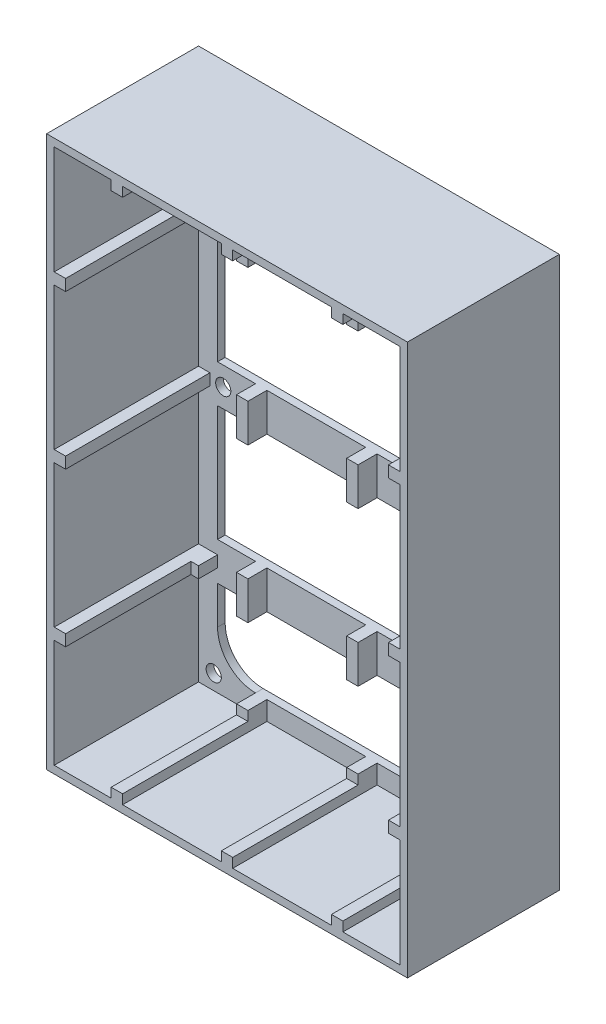
from build123d import *

# Parameters (mm, degrees)
SKETCH1_W           = 95
SKETCH1_H           = 145
BOSS_EXTRUDE1_DEPTH = 20
SKETCH2_W           = 91
SKETCH2_H           = 141
CUT_EXTRUDE1_DEPTH  = 40
SKETCH3_W           = 91
SKETCH3_H           = 141
SKETCH3_W_2         = 81
SKETCH3_H_2         = 30.5
BOSS_EXTRUDE2_DEPTH = 2
CUT_EXTRUDE2_REACH  = 97.459
SKETCH4_R           = 2
SKETCH6_W           = 3
SKETCH6_H           = 2.5
SKETCH6_H_2         = 3
SKETCH6_W_2         = 2
SKETCH6_H_3         = 10
BOSS_EXTRUDE3_DEPTH = 5
SKETCH7_W           = 3
SKETCH7_H           = 3
SKETCH7_H_2         = 2.5
BOSS_EXTRUDE4_DEPTH = 33


with BuildPart() as part:
    # Sketch1 → Boss-Extrude1 (new, symmetric)
    with BuildSketch(Plane.XY):
        Rectangle(SKETCH1_W, SKETCH1_H)
    extrude(amount=BOSS_EXTRUDE1_DEPTH, both=True)

    # Sketch2 → Cut-Extrude1 (cut)
    with BuildSketch(Plane.XY.offset(20)):
        Rectangle(SKETCH2_W, SKETCH2_H)
    extrude(amount=-CUT_EXTRUDE1_DEPTH, mode=Mode.SUBTRACT)

    # Sketch3 → Boss-Extrude2 (add)
    with BuildSketch(Plane(origin=(0, 0, -20), x_dir=(-1, 0, 0), z_dir=(0, 0, -1))):
        Rectangle(SKETCH3_W, SKETCH3_H)
        with Locations((0, -20.25)):
            Rectangle(SKETCH3_W_2, SKETCH3_H_2, mode=Mode.SUBTRACT)
        with BuildLine():
            Line((-40.5, -45.5), (40.5, -45.5))
            Line((40.5, -45.5), (40.5, -55.5))
            ThreePointArc((40.5, -55.5), (37.571067812, -62.571067812), (30.5, -65.5))
            Line((30.5, -65.5), (-30.5, -65.5))
            ThreePointArc((-30.5, -65.5), (-37.571067812, -62.571067812), (-40.5, -55.5))
            Line((-40.5, -55.5), (-40.5, -45.5))
        make_face(mode=Mode.SUBTRACT)
        with Locations((0, 20.25)):
            Rectangle(SKETCH3_W_2, SKETCH3_H_2, mode=Mode.SUBTRACT)
        with BuildLine():
            Line((30.5, 65.5), (-30.5, 65.5))
            ThreePointArc((-30.5, 65.5), (-37.571067812, 62.571067812), (-40.5, 55.5))
            Line((-40.5, 55.5), (-40.5, 45.5))
            Line((-40.5, 45.5), (40.5, 45.5))
            Line((40.5, 45.5), (40.5, 55.5))
            ThreePointArc((40.5, 55.5), (37.571067812, 62.571067812), (30.5, 65.5))
        make_face(mode=Mode.SUBTRACT)
    extrude(amount=-BOSS_EXTRUDE2_DEPTH)

    # Sketch4 → Cut-Extrude2 (cut, up to next)
    with BuildSketch(Plane(origin=(0, 0, -20), x_dir=(-1, 0, 0), z_dir=(0, 0, -1)), mode=Mode.PRIVATE) as cut_extrude2_sk1:
        with Locations((-41.5, 66.5)):
            Circle(SKETCH4_R)
    cut_extrude2_tool1 = extrude(cut_extrude2_sk1.sketch, amount=-CUT_EXTRUDE2_REACH, mode=Mode.PRIVATE) & part.part
    # Sketch4 → Cut-Extrude2 (cut, up to next)
    with BuildSketch(Plane(origin=(0, 0, -20), x_dir=(-1, 0, 0), z_dir=(0, 0, -1)), mode=Mode.PRIVATE) as cut_extrude2_sk2:
        with Locations((41.5, 66.5)):
            Circle(SKETCH4_R)
    cut_extrude2_tool2 = extrude(cut_extrude2_sk2.sketch, amount=-CUT_EXTRUDE2_REACH, mode=Mode.PRIVATE) & part.part
    # Sketch4 → Cut-Extrude2 (cut, up to next)
    with BuildSketch(Plane(origin=(0, 0, -20), x_dir=(-1, 0, 0), z_dir=(0, 0, -1)), mode=Mode.PRIVATE) as cut_extrude2_sk3:
        with Locations(Location((41.5, -66.5, 0), (0, 0, 180))):
            Circle(SKETCH4_R)
    cut_extrude2_tool3 = extrude(cut_extrude2_sk3.sketch, amount=-CUT_EXTRUDE2_REACH, mode=Mode.PRIVATE) & part.part
    # Sketch4 → Cut-Extrude2 (cut, up to next)
    with BuildSketch(Plane(origin=(0, 0, -20), x_dir=(-1, 0, 0), z_dir=(0, 0, -1)), mode=Mode.PRIVATE) as cut_extrude2_sk4:
        with Locations(Location((-41.5, -66.5, 0), (0, 0, 180))):
            Circle(SKETCH4_R)
    cut_extrude2_tool4 = extrude(cut_extrude2_sk4.sketch, amount=-CUT_EXTRUDE2_REACH, mode=Mode.PRIVATE) & part.part
    # Sketch4 → Cut-Extrude2 (cut, up to next)
    with BuildSketch(Plane(origin=(0, 0, -20), x_dir=(-1, 0, 0), z_dir=(0, 0, -1)), mode=Mode.PRIVATE) as cut_extrude2_sk5:
        with Locations((-39, 0)):
            Circle(SKETCH4_R)
    cut_extrude2_tool5 = extrude(cut_extrude2_sk5.sketch, amount=-CUT_EXTRUDE2_REACH, mode=Mode.PRIVATE) & part.part
    # Sketch4 → Cut-Extrude2 (cut, up to next)
    with BuildSketch(Plane(origin=(0, 0, -20), x_dir=(-1, 0, 0), z_dir=(0, 0, -1)), mode=Mode.PRIVATE) as cut_extrude2_sk6:
        with Locations((39, 0)):
            Circle(SKETCH4_R)
    cut_extrude2_tool6 = extrude(cut_extrude2_sk6.sketch, amount=-CUT_EXTRUDE2_REACH, mode=Mode.PRIVATE) & part.part
    add(cut_extrude2_tool1.solids().sort_by_distance((41.5, 66.5, -20))[0], mode=Mode.SUBTRACT)
    add(cut_extrude2_tool2.solids().sort_by_distance((-41.5, 66.5, -20))[0], mode=Mode.SUBTRACT)
    add(cut_extrude2_tool3.solids().sort_by_distance((-41.5, -66.5, -20))[0], mode=Mode.SUBTRACT)
    add(cut_extrude2_tool4.solids().sort_by_distance((41.5, -66.5, -20))[0], mode=Mode.SUBTRACT)
    add(cut_extrude2_tool5.solids().sort_by_distance((39, 0, -20))[0], mode=Mode.SUBTRACT)
    add(cut_extrude2_tool6.solids().sort_by_distance((-39, 0, -20))[0], mode=Mode.SUBTRACT)

    # Sketch6 → Boss-Extrude3 (add)
    with BuildSketch(Plane.XY.offset(-18)):
        with Locations((-29, 69.25)):
            Rectangle(SKETCH6_W, SKETCH6_H)
        with Locations((-29, 66.75)):
            Rectangle(SKETCH6_W, SKETCH6_H)
        with Locations((0, 66.75)):
            Rectangle(SKETCH6_W, SKETCH6_H)
        with Locations((0, 69.25)):
            Rectangle(SKETCH6_W, SKETCH6_H)
        with Locations((29, 69.25)):
            Rectangle(SKETCH6_W, SKETCH6_H)
        with Locations((29, 66.75)):
            Rectangle(SKETCH6_W, SKETCH6_H)
        with Locations((44, 40.5)):
            Rectangle(SKETCH6_W, SKETCH6_H_2)
        with Locations((41.5, 40.5)):
            Rectangle(SKETCH6_W_2, SKETCH6_H_2)
        with Locations((29, 40.5)):
            Rectangle(SKETCH6_W, SKETCH6_H_3)
        with Locations((-29, 40.5)):
            Rectangle(SKETCH6_W, SKETCH6_H_3)
        with Locations((-44, 40.5)):
            Rectangle(SKETCH6_W, SKETCH6_H_2)
        with Locations((-41.5, 40.5)):
            Rectangle(SKETCH6_W_2, SKETCH6_H_2)
        with Locations((44, 0)):
            Rectangle(SKETCH6_W, SKETCH6_H_2)
        with Locations((29, 0)):
            Rectangle(SKETCH6_W, SKETCH6_H_3)
        with Locations((-29, 0)):
            Rectangle(SKETCH6_W, SKETCH6_H_3)
        with Locations((-44, 0)):
            Rectangle(SKETCH6_W, SKETCH6_H_2)
        with Locations((-44, -40.5)):
            Rectangle(SKETCH6_W, SKETCH6_H_2)
        with Locations((-41.5, -40.5)):
            Rectangle(SKETCH6_W_2, SKETCH6_H_2)
        with Locations((-29, -40.5)):
            Rectangle(SKETCH6_W, SKETCH6_H_3)
        with Locations((29, -40.5)):
            Rectangle(SKETCH6_W, SKETCH6_H_3)
        with Locations((41.5, -40.5)):
            Rectangle(SKETCH6_W_2, SKETCH6_H_2)
        with Locations((44, -40.5)):
            Rectangle(SKETCH6_W, SKETCH6_H_2)
        with Locations((-29, -69.25)):
            Rectangle(SKETCH6_W, SKETCH6_H)
        with Locations((-29, -66.75)):
            Rectangle(SKETCH6_W, SKETCH6_H)
        with Locations((0, -66.75)):
            Rectangle(SKETCH6_W, SKETCH6_H)
        with Locations((0, -69.25)):
            Rectangle(SKETCH6_W, SKETCH6_H)
        with Locations((29, -69.25)):
            Rectangle(SKETCH6_W, SKETCH6_H)
        with Locations((29, -66.75)):
            Rectangle(SKETCH6_W, SKETCH6_H)
        with Locations((0, 40.5)):
            Rectangle(SKETCH6_W, SKETCH6_H_3)
        Rectangle(SKETCH6_W, SKETCH6_H_3)
        with Locations((0, -40.5)):
            Rectangle(SKETCH6_W, SKETCH6_H_3)
    extrude(amount=BOSS_EXTRUDE3_DEPTH)

    # Sketch7 → Boss-Extrude4 (add)
    with BuildSketch(Plane.XY.offset(-13)):
        with Locations((-44, 40.5)):
            Rectangle(SKETCH7_W, SKETCH7_H)
        with Locations((-29, 69.25)):
            Rectangle(SKETCH7_W, SKETCH7_H_2)
        with Locations((-44, 0)):
            Rectangle(SKETCH7_W, SKETCH7_H)
        with Locations((-44, -40.5)):
            Rectangle(SKETCH7_W, SKETCH7_H)
        with Locations((-29, -69.25)):
            Rectangle(SKETCH7_W, SKETCH7_H_2)
        with Locations((0, -69.25)):
            Rectangle(SKETCH7_W, SKETCH7_H_2)
        with Locations((29, -69.25)):
            Rectangle(SKETCH7_W, SKETCH7_H_2)
        with Locations((44, -40.5)):
            Rectangle(SKETCH7_W, SKETCH7_H)
        with Locations((44, 0)):
            Rectangle(SKETCH7_W, SKETCH7_H)
        with Locations((44, 40.5)):
            Rectangle(SKETCH7_W, SKETCH7_H)
        with Locations((29, 69.25)):
            Rectangle(SKETCH7_W, SKETCH7_H_2)
        with Locations((0, 69.25)):
            Rectangle(SKETCH7_W, SKETCH7_H_2)
    extrude(amount=BOSS_EXTRUDE4_DEPTH)


solid = part.part
